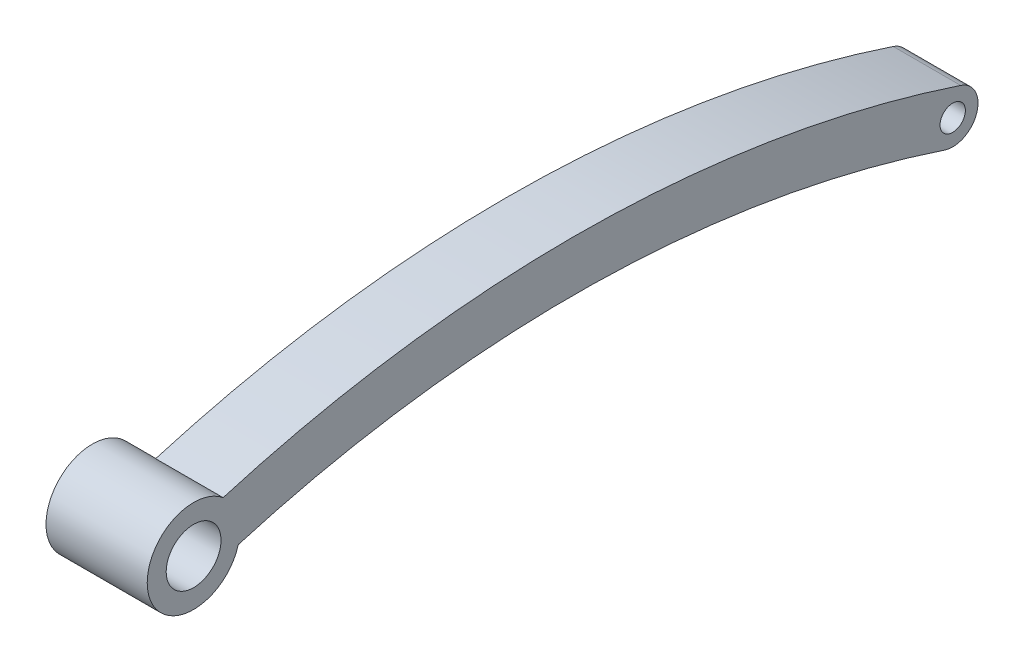
from build123d import *

# Parameters (mm, degrees)
SKETCH1_R           = 0.75
BOSS_EXTRUDE1_DEPTH = 4
SKETCH3_R           = 2.75
BOSS_EXTRUDE3_DEPTH = 4
SKETCH4_R           = 1.625
CUT_EXTRUDE1_DEPTH  = 4
BOSS_EXTRUDE4_START = 2
SKETCH5_R           = 2.75
SKETCH5_R_2         = 1.625
BOSS_EXTRUDE4_DEPTH = 2


with BuildPart() as part:
    # Sketch1 → Boss-Extrude1 (new body)
    with BuildSketch(Plane(origin=(0, 0, 0), x_dir=(0, 0, -1), z_dir=(1, 0, 0))):
        with BuildLine():
            ThreePointArc((-0.472027972, 1.423794084), (-1.423794084, -0.472027972), (0.472027972, -1.423794084))
            ThreePointArc((0.472027972, -1.423794084), (22.5, 2.132481996), (44.527972028, -1.423794084))
            ThreePointArc((44.527972028, -1.423794084), (46.423794084, -0.472027972), (45.472027972, 1.423794084))
            ThreePointArc((45.472027972, 1.423794084), (22.5, 5.132481996), (-0.472027972, 1.423794084))
        make_face()
        with Locations((45, 0)):
            Circle(SKETCH1_R, mode=Mode.SUBTRACT)
    extrude(amount=BOSS_EXTRUDE1_DEPTH)

    # Sketch3 → Boss-Extrude3 (add)
    with BuildSketch(Plane.ZY):
        Circle(SKETCH3_R)
    extrude(amount=-BOSS_EXTRUDE3_DEPTH)

    # Sketch4 → Cut-Extrude1 (cut)
    with BuildSketch(Plane.ZY):
        Circle(SKETCH4_R)
    extrude(amount=-CUT_EXTRUDE1_DEPTH, mode=Mode.SUBTRACT)

    # Sketch5 → Boss-Extrude4 (add)
    with BuildSketch(Plane.ZY.offset(BOSS_EXTRUDE4_START)):
        Circle(SKETCH5_R)
        Circle(SKETCH5_R_2, mode=Mode.SUBTRACT)
    extrude(amount=-BOSS_EXTRUDE4_DEPTH)


solid = part.part
